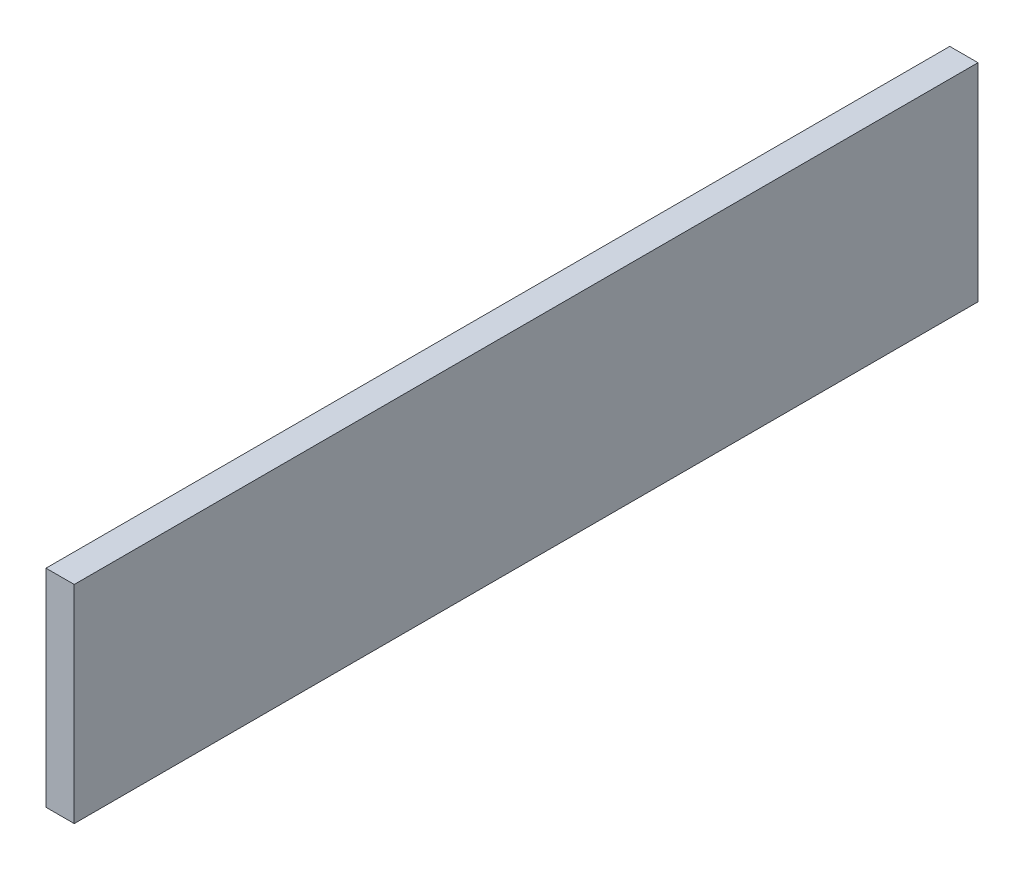
from build123d import *

# Parameters (mm, degrees)
SKETCH1_W           = 609.6
SKETCH1_H           = 139.7
BOSS_EXTRUDE1_DEPTH = 19.05


with BuildPart() as part:
    # Sketch1 → Boss-Extrude1 (new body)
    with BuildSketch(Plane(origin=(0, 0, 0), x_dir=(0, 0, -1), z_dir=(1, 0, 0))):
        with Locations((304.8, 69.85)):
            Rectangle(SKETCH1_W, SKETCH1_H)
    extrude(amount=BOSS_EXTRUDE1_DEPTH)


solid = part.part
